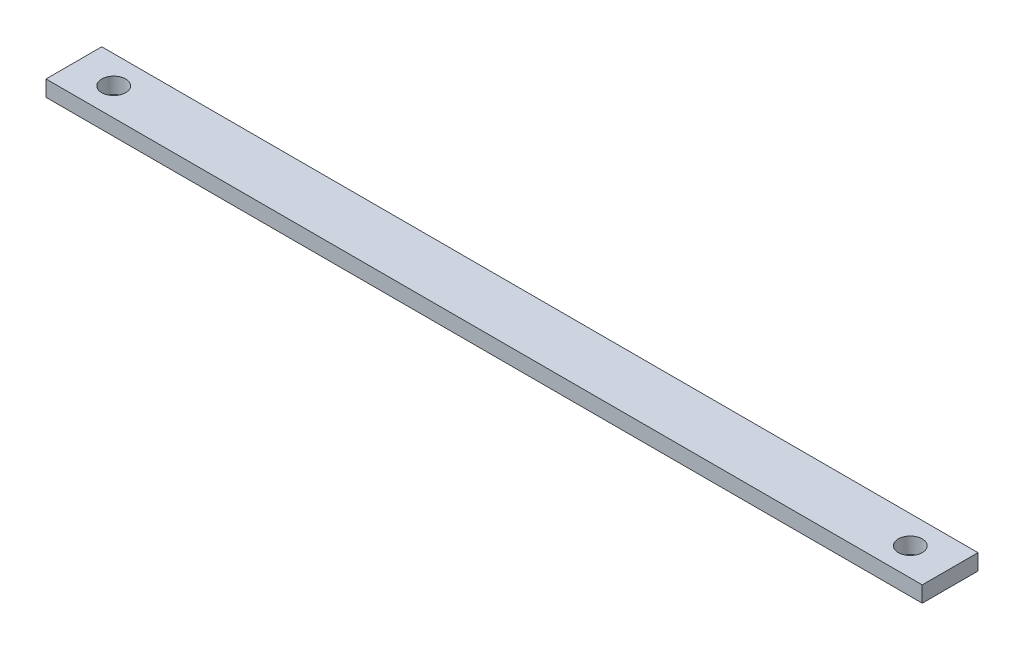
from build123d import *

# Parameters (mm, degrees)
SKETCH3_W           = 110
SKETCH3_H           = 7
SKETCH3_R           = 1.5
BOSS_EXTRUDE1_DEPTH = 2


with BuildPart() as part:
    # Sketch3 → Boss-Extrude1 (new body)
    with BuildSketch(Plane(origin=(0, 0, 0), x_dir=(1, 0, 0), z_dir=(0, 1, 0))):
        Rectangle(SKETCH3_W, SKETCH3_H)
        with Locations(Location((-50, 0, 0), (0, 0, 270))):
            Circle(SKETCH3_R, mode=Mode.SUBTRACT)
        with Locations(Location((50, 0, 0), (0, 0, 90))):
            Circle(SKETCH3_R, mode=Mode.SUBTRACT)
    extrude(amount=BOSS_EXTRUDE1_DEPTH)


solid = part.part
